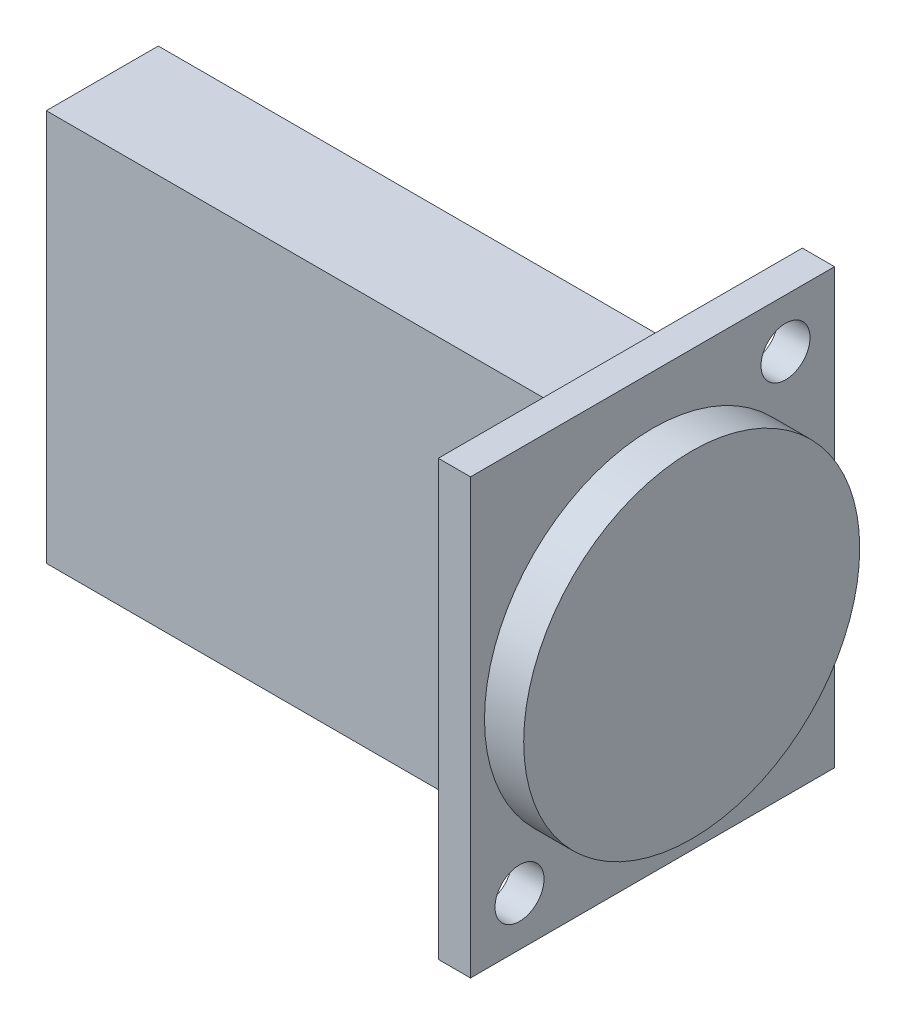
from build123d import *

# Parameters (mm, degrees)
SKETCH2_W           = 26
SKETCH2_H           = 31
SKETCH2_R           = 1.75
BOSS_EXTRUDE1_DEPTH = 2.3
SKETCH3_R           = 12
BOSS_EXTRUDE2_DEPTH = 2.8
SKETCH4_W           = 8
SKETCH4_H           = 28
BOSS_EXTRUDE3_DEPTH = 37


with BuildPart() as part:
    # Sketch2 → Boss-Extrude1 (new body)
    with BuildSketch(Plane(origin=(0, 0, 0), x_dir=(0, 0, -1), z_dir=(1, 0, 0))):
        Rectangle(SKETCH2_W, SKETCH2_H)
        with Locations((-9.5, -12)):
            Circle(SKETCH2_R, mode=Mode.SUBTRACT)
        with Locations((9.5, 12)):
            Circle(SKETCH2_R, mode=Mode.SUBTRACT)
    extrude(amount=BOSS_EXTRUDE1_DEPTH)

    # Sketch3 → Boss-Extrude2 (add)
    with BuildSketch(Plane(origin=(2.3, 0, 0), x_dir=(0, 0, -1), z_dir=(1, 0, 0))):
        Circle(SKETCH3_R)
    extrude(amount=BOSS_EXTRUDE2_DEPTH)

    # Sketch4 → Boss-Extrude3 (add)
    with BuildSketch(Plane.ZY):
        Rectangle(SKETCH4_W, SKETCH4_H)
    extrude(amount=BOSS_EXTRUDE3_DEPTH)


solid = part.part
